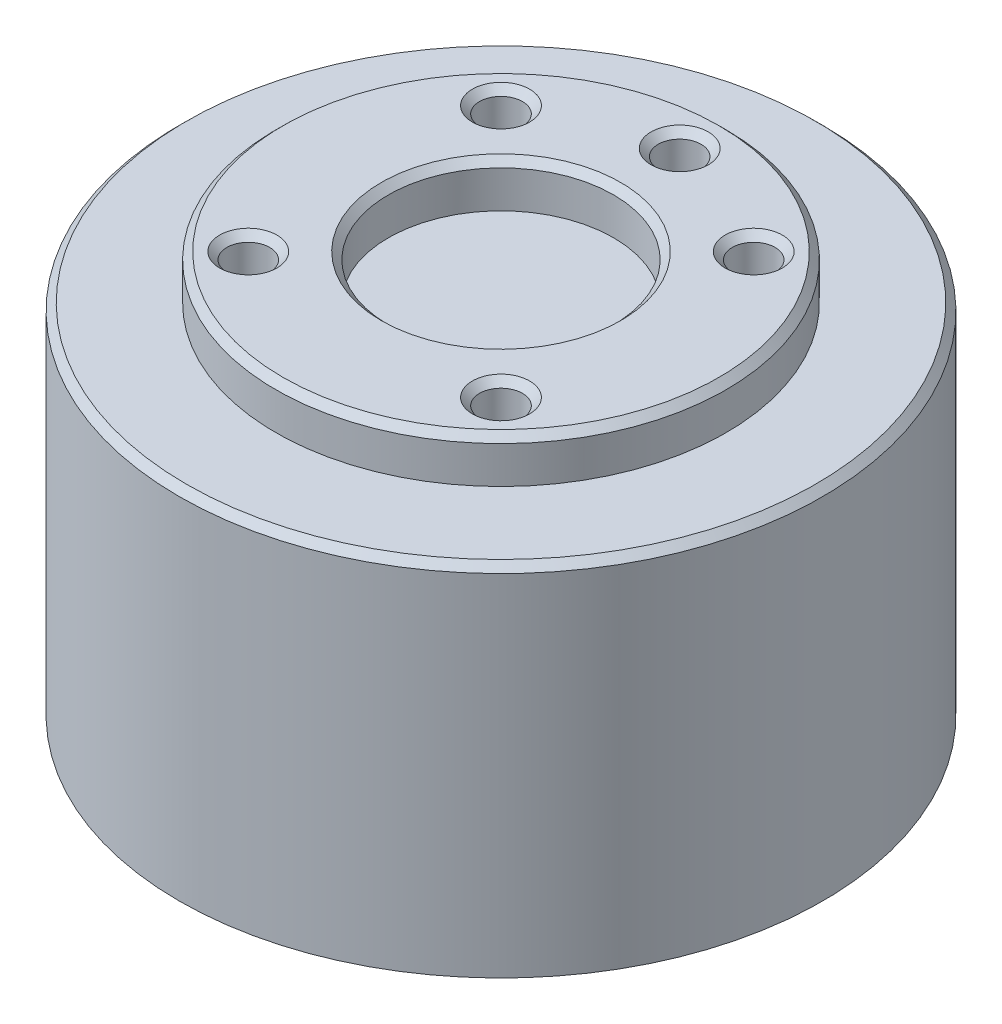
from build123d import *

# Parameters (mm, degrees)
SKIZZE1_R                       = 45
AUFSATZ_LINEAR_AUSTRAGEN1_DEPTH = 50
SKIZZE2_R                       = 31.5
SKIZZE2_R_2                     = 15.75
SKIZZE2_R_3                     = 3
AUFSATZ_LINEAR_AUSTRAGEN2_DEPTH = 6.2
FASE1_SIZE                      = 1


with BuildPart() as part:
    # Skizze1 → Aufsatz-Linear austragen1 (new body)
    with BuildSketch(Plane(origin=(0, 0, 0), x_dir=(1, 0, 0), z_dir=(0, 1, 0))):
        with Locations(Location((0, 0, 0), (0, 0, 270))):
            Circle(SKIZZE1_R)
    extrude(amount=AUFSATZ_LINEAR_AUSTRAGEN1_DEPTH)

    # Skizze2 → Aufsatz-Linear austragen2 (add)
    with BuildSketch(Plane(origin=(0, 50, 0), x_dir=(1, 0, 0), z_dir=(0, 1, 0))):
        with Locations(Location((0, 0, 0), (0, 0, 90))):
            Circle(SKIZZE2_R)
        with Locations(Location((0, 0, 0), (0, 0, 90))):
            Circle(SKIZZE2_R_2, mode=Mode.SUBTRACT)
        with Locations(Location((17.67766953, 17.67766953, 0), (0, 0, 90))):
            Circle(SKIZZE2_R_3, mode=Mode.SUBTRACT)
        with Locations(Location((0, 25, 0), (0, 0, 90))):
            Circle(SKIZZE2_R_3, mode=Mode.SUBTRACT)
        with Locations(Location((17.67766953, -17.67766953, 0), (0, 0, 90))):
            Circle(SKIZZE2_R_3, mode=Mode.SUBTRACT)
        with Locations(Location((-17.67766953, -17.67766953, 0), (0, 0, 90))):
            Circle(SKIZZE2_R_3, mode=Mode.SUBTRACT)
        with Locations(Location((-17.67766953, 17.67766953, 0), (0, 0, 90))):
            Circle(SKIZZE2_R_3, mode=Mode.SUBTRACT)
    extrude(amount=AUFSATZ_LINEAR_AUSTRAGEN2_DEPTH)

    # Fase1
    fase1_edges = [part.edges().sort_by_distance(p)[0] for p in [
        (0, 56.2, 31.5),
        (0, 56.2, 15.75),
        (17.67766953, 56.2, -14.67766953),
        (0, 56.2, -22),
        (17.67766953, 56.2, 20.67766953),
        (-17.67766953, 56.2, 20.67766953),
        (-17.67766953, 56.2, -14.67766953),
        (0, 50, -45),
    ]]
    chamfer(fase1_edges, length=FASE1_SIZE)


solid = part.part
